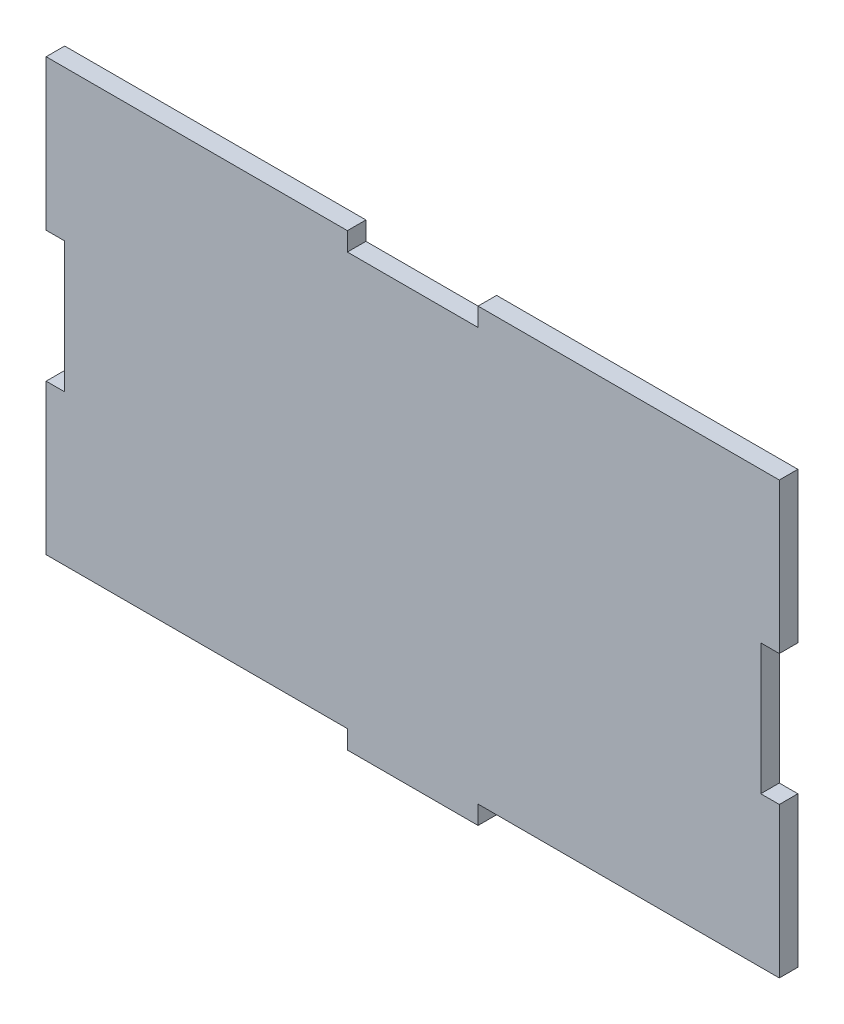
from build123d import *

# Parameters (mm, degrees)
BOSS_EXTRUDE1_DEPTH = 4.3


with BuildPart() as part:
    # Sketch1 → Boss-Extrude1 (new body)
    with BuildSketch(Plane.XY):
        Polygon((-85, 15.15), (-85, 50), (-15.15, 50), (-15.15, 45.7), (15.15, 45.7), (15.15, 50), (85, 50), (85, 15.15), (80.7, 15.15), (80.7, -15.15), (85, -15.15), (85, -50), (15.15, -50), (15.15, -54.3), (-15.15, -54.3), (-15.15, -50), (-85, -50), (-85, -15.15), (-80.7, -15.15), (-80.7, 15.15), align=None)
    extrude(amount=BOSS_EXTRUDE1_DEPTH)


solid = part.part
